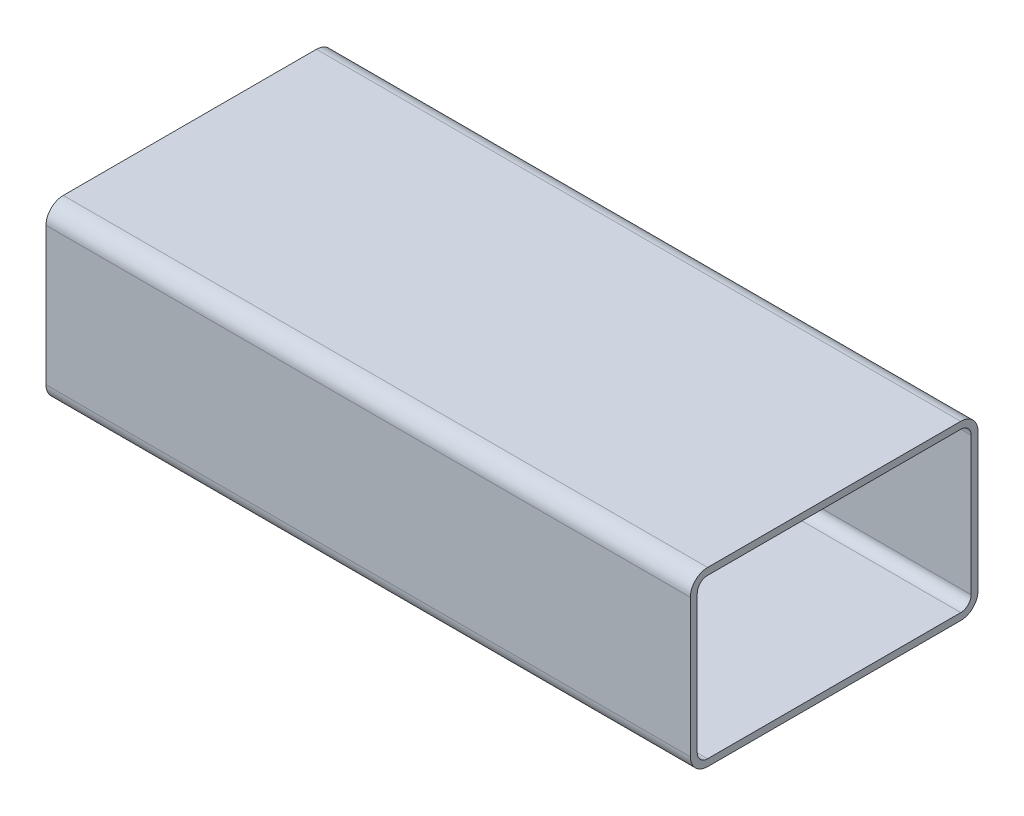
from build123d import *

# Parameters (mm, degrees)
TUBO_RETANGULAR_50_X_30_X_2_6_1_DEPTH = 112


with BuildPart() as part:
    # Sketch1 → Tubo retangular 50 X 30 X 2.6(1) (new body)
    with BuildSketch(Plane.YZ):
        with BuildLine():
            Line((-12, -25), (12, -25))
            ThreePointArc((12, -25), (14.121320344, -24.121320344), (15, -22))
            Line((15, -22), (15, 22))
            ThreePointArc((15, 22), (14.121320344, 24.121320344), (12, 25))
            Line((12, 25), (-12, 25))
            ThreePointArc((-12, 25), (-14.121320344, 24.121320344), (-15, 22))
            Line((-15, 22), (-15, -22))
            ThreePointArc((-15, -22), (-14.121320344, -24.121320344), (-12, -25))
        make_face()
        with BuildLine():
            Line((-12, -23.8), (12, -23.8))
            ThreePointArc((12, -23.8), (13.272792206, -23.272792206), (13.8, -22))
            Line((13.8, -22), (13.8, 22))
            ThreePointArc((13.8, 22), (13.272792206, 23.272792206), (12, 23.8))
            Line((12, 23.8), (-12, 23.8))
            ThreePointArc((-12, 23.8), (-13.272792206, 23.272792206), (-13.8, 22))
            Line((-13.8, 22), (-13.8, -22))
            ThreePointArc((-13.8, -22), (-13.272792206, -23.272792206), (-12, -23.8))
        make_face(mode=Mode.SUBTRACT)
    extrude(amount=TUBO_RETANGULAR_50_X_30_X_2_6_1_DEPTH)


solid = part.part
